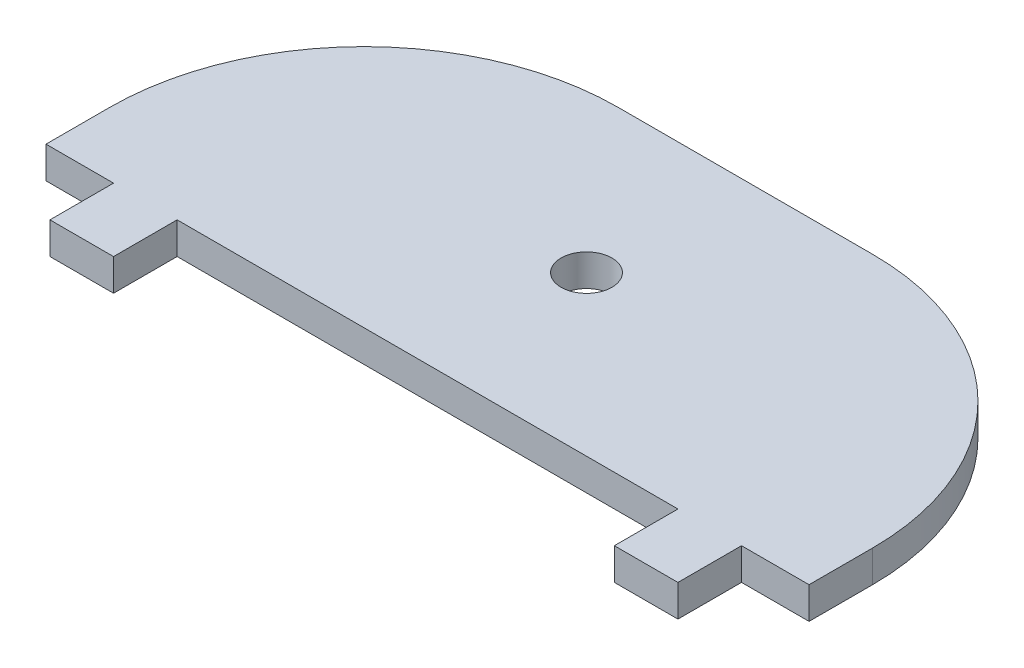
from build123d import *

# Parameters (mm, degrees)
SKETCH1_R           = 2
BOSS_EXTRUDE1_DEPTH = 1.25
FILLET1_R           = 20


with BuildPart() as part:
    # Sketch1 → Boss-Extrude1 (new, symmetric)
    with BuildSketch(Plane(origin=(0, 0, 0), x_dir=(1, 0, 0), z_dir=(0, 1, 0))):
        Polygon((30, -12.5), (30, 12.5), (-30, 12.5), (-30, -12.5), (-24.69, -12.5), (-24.69, -17.5), (-19.69, -17.5), (-19.69, -12.5), (19.69, -12.5), (19.69, -17.5), (24.69, -17.5), (24.69, -12.5), align=None)
        with Locations(Location((0, 0, 0), (0, 0, 270))):
            Circle(SKETCH1_R, mode=Mode.SUBTRACT)
    extrude(amount=BOSS_EXTRUDE1_DEPTH, both=True)

    # Fillet1
    fillet1_edges = [part.edges().sort_by_distance(p)[0] for p in [
        (-30, 0, -12.5),
        (30, 0, -12.5),
    ]]
    fillet(fillet1_edges, radius=FILLET1_R)


solid = part.part
